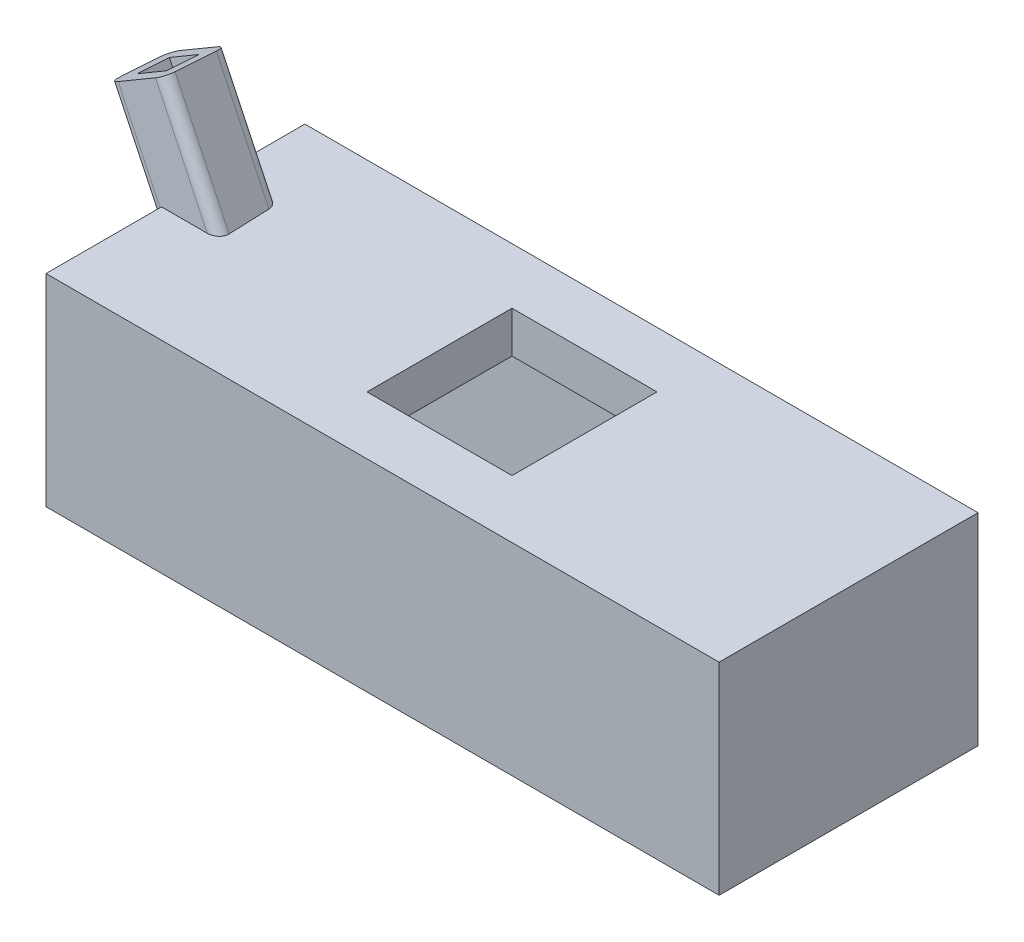
from build123d import *

# Parameters (mm, degrees)
CROQUIS1_W              = 19
CROQUIS1_H              = 19
SALIENTE_EXTRUIR1_DEPTH = 4
CROQUIS2_W              = 14
CROQUIS2_H              = 14
CORTAR_EXTRUIR1_DEPTH   = 4
SALIENTE_EXTRUIR2_DEPTH = 4
CROQUIS9_W              = 6
CROQUIS9_H              = 6
SALIENTE_EXTRUIR6_DEPTH = 20
CROQUIS11_W             = 3.15
CROQUIS11_H             = 3.15
CORTAR_EXTRUIR3_DEPTH   = 20
REDONDEO1_R             = 3
REDONDEO2_R             = 3
REDONDEO3_R             = 3
REDONDEO6_R             = 1
REDONDEO7_R             = 1
SALIENTE_EXTRUIR7_START = -4
CROQUIS12_W             = 65
CROQUIS12_H             = 25
CROQUIS12_W_2           = 14
CROQUIS12_H_2           = 14
SALIENTE_EXTRUIR7_DEPTH = 4
CROQUIS13_W             = 65
CROQUIS13_H             = 25
CROQUIS13_W_2           = 60
CROQUIS13_H_2           = 22.4
SALIENTE_EXTRUIR8_DEPTH = 19.5
CROQUIS15_W             = 3.15
CROQUIS15_H             = 3.15
CORTAR_EXTRUIR4_DEPTH   = 20


with BuildPart() as part:
    # Croquis1 → Saliente-Extruir1 (new body)
    with BuildSketch(Plane(origin=(0, 0, 0), x_dir=(1, 0, 0), z_dir=(0, 1, 0))):
        Rectangle(CROQUIS1_W, CROQUIS1_H)
    extrude(amount=SALIENTE_EXTRUIR1_DEPTH)

    # Croquis2 → Cortar-Extruir1 (cut)
    with BuildSketch(Plane(origin=(0, 4, 0), x_dir=(1, 0, 0), z_dir=(0, 1, 0))):
        with Locations((-0.75, 1.5)):
            Rectangle(CROQUIS2_W, CROQUIS2_H)
    extrude(amount=-CORTAR_EXTRUIR1_DEPTH, mode=Mode.SUBTRACT)

    # Croquis3 → Saliente-Extruir2 (add)
    with BuildSketch(Plane(origin=(0, 4, 0), x_dir=(1, 0, 0), z_dir=(0, 1, 0))):
        Polygon((-9.5, 9.5), (-31.5, 5.730831712), (-31.5, 0.051028536), (-9.5, -2.5), align=None)
    extrude(amount=-SALIENTE_EXTRUIR2_DEPTH)

    # Croquis9 → Saliente-Extruir6 (add)
    with BuildSketch(Plane(origin=(-14.459222514, 25.211914346, -1.676631329), x_dir=(0.8679382707913074, 0.4955774572451805, -0.03295666800810758), z_dir=(-0.49667208306466687, 0.8660254037844359, -0.05759202986706984))):
        with Locations((-24.954381149, 2.785496138)):
            Rectangle(CROQUIS9_W, CROQUIS9_H)
    extrude(amount=-SALIENTE_EXTRUIR6_DEPTH)

    # Croquis11 → Cortar-Extruir3 (cut)
    with BuildSketch(Plane(origin=(-14.459222514, 25.211914346, -1.676631329), x_dir=(0.8679382707913073, 0.4955774572451806, -0.032956668008107474), z_dir=(-0.4966720830646669, 0.8660254037844358, -0.05759202986706968))):
        with Locations((-24.954381149, 2.785496138)):
            Rectangle(CROQUIS11_W, CROQUIS11_H)
    extrude(amount=-CORTAR_EXTRUIR3_DEPTH, mode=Mode.SUBTRACT)

    # Redondeo1
    redondeo1_edges = [part.edges().sort_by_distance(p)[0] for p in [
        (9.5, 2, -9.5),
        (9.5, 2, 9.5),
        (-9.5, 2, 9.5),
    ]]
    fillet(redondeo1_edges, radius=REDONDEO1_R)

    # Redondeo2
    redondeo2_edges = [part.edges().sort_by_distance(p)[0] for p in [
        (-9.5, 2, -9.5),
    ]]
    fillet(redondeo2_edges, radius=REDONDEO2_R)

    # Redondeo3
    redondeo3_edges = [part.edges().sort_by_distance(p)[0] for p in [
        (-9.5, 2, 2.5),
    ]]
    fillet(redondeo3_edges, radius=REDONDEO3_R)

    # Redondeo6
    redondeo6_edges = [part.edges().sort_by_distance(p)[0] for p in [
        (-24.54793036, -1.686293309, -5.686133961),
        (-30.661666234, 8.973960729, -6.395057355),
        (-30.547500987, 9.17302568, -0.395042751),
        (-24.433765113, -1.487228357, 0.313880643),
        (-33.755178919, 2.71233258, 0.03460334),
    ]]
    fillet(redondeo6_edges, radius=REDONDEO6_R)

    # Redondeo7
    redondeo7_edges = [part.edges().sort_by_distance(p)[0] for p in [
        (-33.755178919, 2.314202677, -5.952173136),
    ]]
    fillet(redondeo7_edges, radius=REDONDEO7_R)

    # Croquis12 → Saliente-Extruir7 (add)
    with BuildSketch(Plane(origin=(0, 4, 0), x_dir=(1, 0, 0), z_dir=(0, 1, 0)).offset(SALIENTE_EXTRUIR7_START)):
        with Locations((-0.65, 1.4)):
            Rectangle(CROQUIS12_W, CROQUIS12_H)
        with Locations((-0.75, 1.5)):
            Rectangle(CROQUIS12_W_2, CROQUIS12_H_2, mode=Mode.SUBTRACT)
    extrude(amount=SALIENTE_EXTRUIR7_DEPTH)

    # Croquis13 → Saliente-Extruir8 (add)
    with BuildSketch(Plane(origin=(0, 4, 0), x_dir=(1, 0, 0), z_dir=(0, 1, 0))):
        with Locations((-0.65, 1.4)):
            Rectangle(CROQUIS13_W, CROQUIS13_H)
        with Locations((-0.65, 1.4)):
            Rectangle(CROQUIS13_W_2, CROQUIS13_H_2, mode=Mode.SUBTRACT)
    extrude(amount=-SALIENTE_EXTRUIR8_DEPTH)

    # Croquis15 → Cortar-Extruir4 (cut)
    with BuildSketch(Plane(origin=(-14.459222514, 25.211914346, -1.676631329), x_dir=(0.8679382707913073, 0.4955774572451806, -0.032956668008107474), z_dir=(-0.4966720830646669, 0.8660254037844358, -0.05759202986706968))):
        with Locations((-24.954381149, 2.785496138)):
            Rectangle(CROQUIS15_W, CROQUIS15_H)
    extrude(amount=-CORTAR_EXTRUIR4_DEPTH, mode=Mode.SUBTRACT)


solid = part.part
